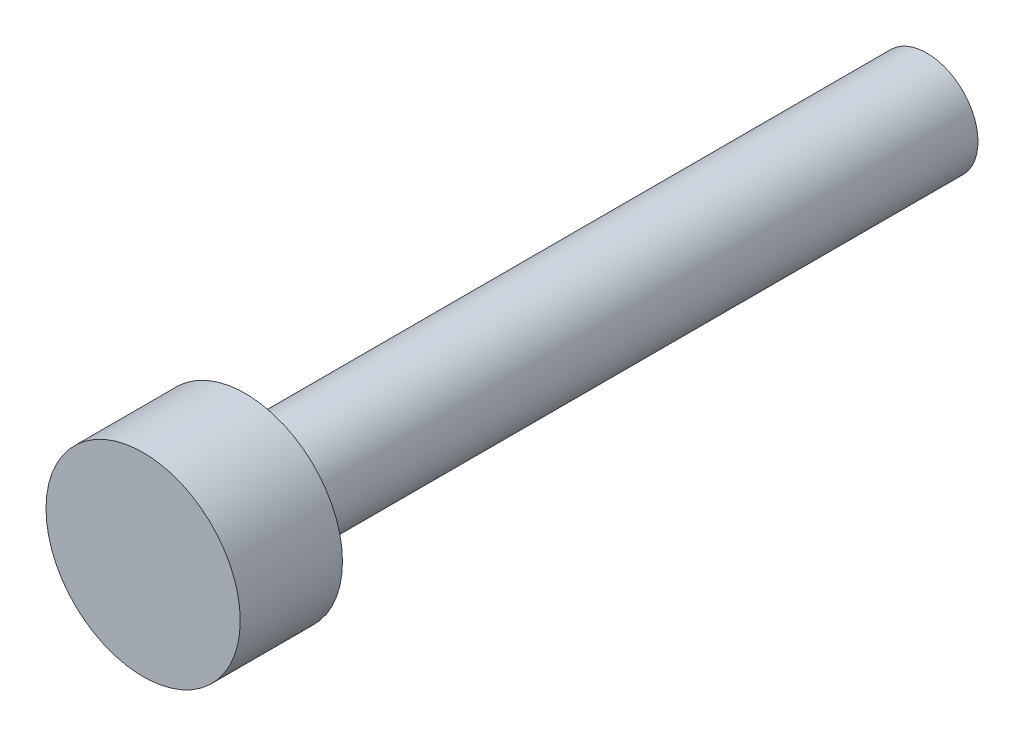
from build123d import *

# Parameters (mm, degrees)
SKETCH1_R           = 1.5
BOSS_EXTRUDE1_DEPTH = 20
SKETCH2_R           = 2.85
BOSS_EXTRUDE2_DEPTH = 3


with BuildPart() as part:
    # Sketch1 → Boss-Extrude1 (new body)
    with BuildSketch(Plane.XY):
        Circle(SKETCH1_R)
    extrude(amount=BOSS_EXTRUDE1_DEPTH)

    # Sketch2 → Boss-Extrude2 (add)
    with BuildSketch(Plane.XY.offset(20)):
        Circle(SKETCH2_R)
    extrude(amount=BOSS_EXTRUDE2_DEPTH)


solid = part.part
